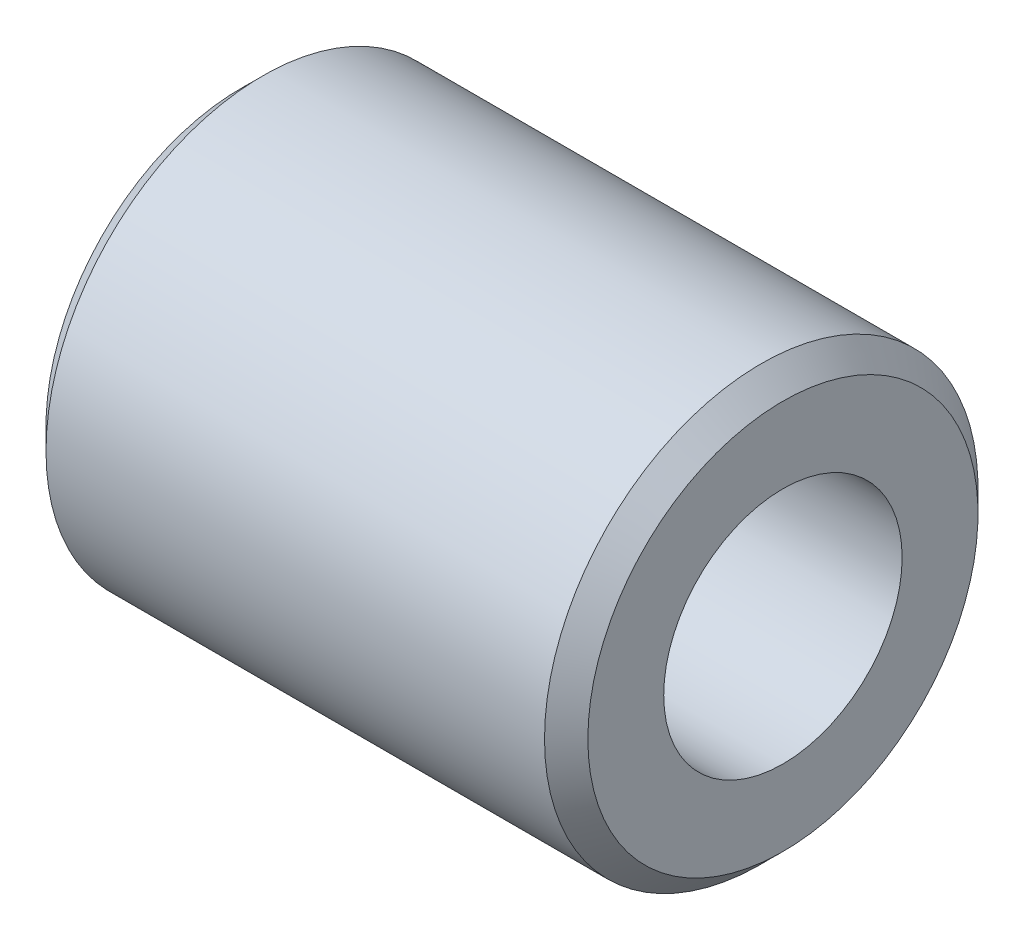
from build123d import *

# Parameters (mm, degrees)
CHAMFER_1_SIZE = 5


with BuildPart() as part:
    # 草图1 → 旋转1 (revolve)
    with BuildSketch(Plane.XY, mode=Mode.PRIVATE) as revolve_1_sk:
        Polygon((83, 30), (83, 27.5), (125, 27.5), (125, 50), (0, 50), (0, 27.5), (42, 27.5), (42, 30), align=None)
    revolve(revolve_1_sk.sketch.rotate(Axis((0, 0, 0), (1, 0, 0)), 90), axis=Axis((0, 0, 0), (1, 0, 0)))

    # 倒角1
    chamfer_1_edges = [part.edges().sort_by_distance(p)[0] for p in [
        (0, 0, -50),
        (125, 0, -50),
    ]]
    chamfer(chamfer_1_edges, length=CHAMFER_1_SIZE)


solid = part.part
